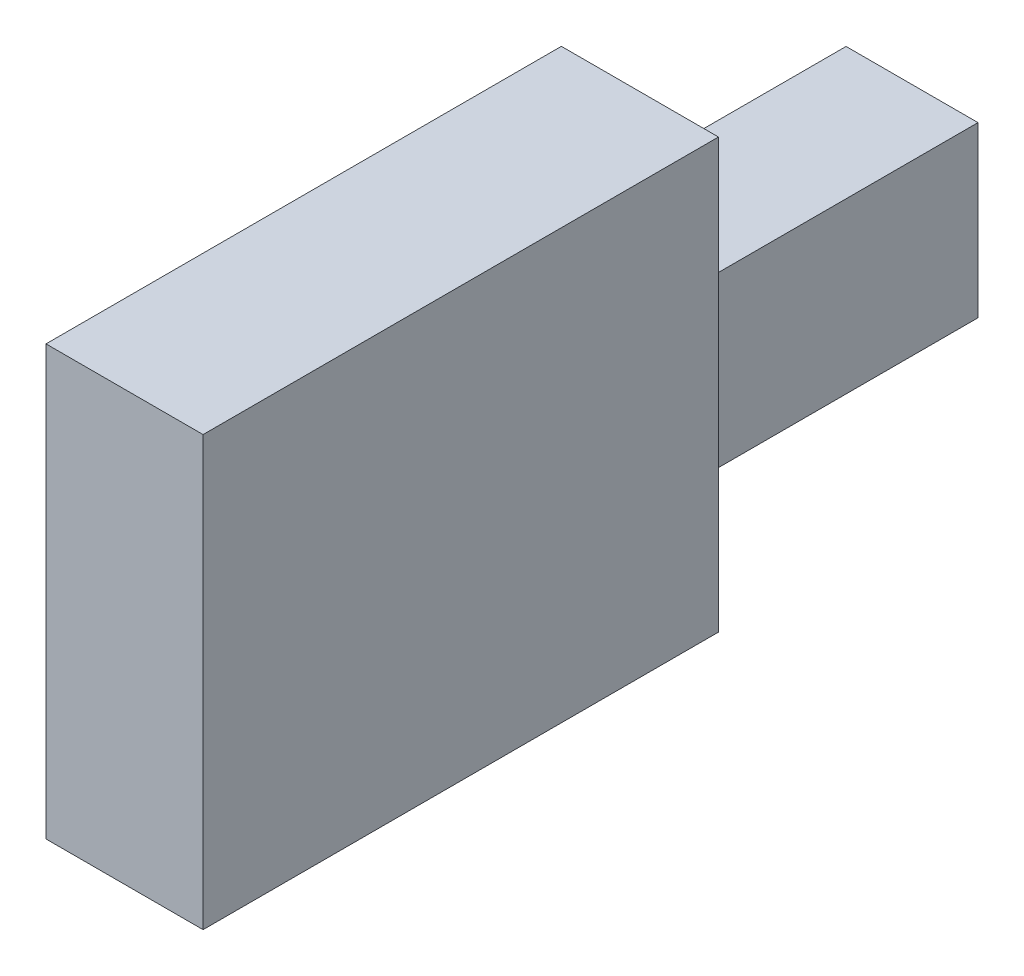
from build123d import *

# Parameters (mm, degrees)
SKETCH1_W           = 3.2
SKETCH1_H           = 4.1
BOSS_EXTRUDE1_DEPTH = 6.6
SKETCH2_W           = 3.81
SKETCH2_H           = 10.4
BOSS_EXTRUDE2_DEPTH = 12.5


with BuildPart() as part:
    # Sketch1 → Boss-Extrude1 (new body)
    with BuildSketch(Plane.XY):
        Rectangle(SKETCH1_W, SKETCH1_H)
    extrude(amount=BOSS_EXTRUDE1_DEPTH)

    # Sketch2 → Boss-Extrude2 (add)
    with BuildSketch(Plane.XY.offset(6.6)):
        Rectangle(SKETCH2_W, SKETCH2_H)
    extrude(amount=BOSS_EXTRUDE2_DEPTH)


solid = part.part
